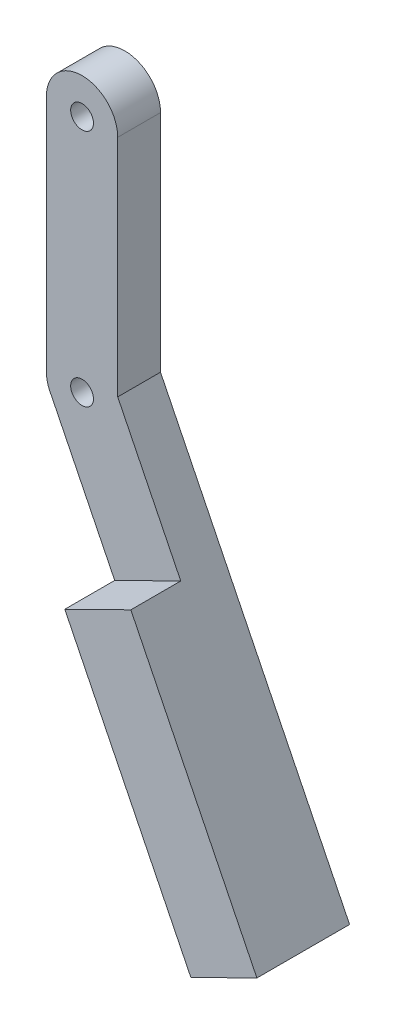
from build123d import *

# Parameters (mm, degrees)
SALIENTE_EXTRUIR1_DEPTH = 6
CROQUIS2_R              = 1.6
CORTAR_EXTRUIR1_DEPTH   = 65.918146911
SALIENTE_EXTRUIR2_DEPTH = 7


with BuildPart() as part:
    # Croquis1 → Saliente-Extruir1 (new body)
    with BuildSketch(Plane.XY):
        with BuildLine():
            Line((-5, 33.48), (-5, 0))
            ThreePointArc((-5, 0), (0, -5), (5, 0))
            Line((5, 0), (5, 33.48))
            ThreePointArc((5, 33.48), (0, 38.48), (-5, 33.48))
        make_face()
        with BuildLine():
            ThreePointArc((5, 0), (1.357892891, -4.812081348), (-4.262450759, -2.613716421))
            Line((-4.262450759, -2.613716421), (22.256084979, -56.435340907))
            Line((22.256084979, -56.435340907), (31.518535738, -51.871624486))
            Line((31.518535738, -51.871624486), (5, 1.95))
            Line((5, 1.95), (5, 0))
        make_face()
    extrude(amount=SALIENTE_EXTRUIR1_DEPTH)

    # Croquis2 → Cortar-Extruir1 (cut, through all)
    with BuildSketch(Plane.XY.offset(6)):
        with Locations((0, 33.48)):
            Circle(CROQUIS2_R)
        Circle(CROQUIS2_R)
    extrude(amount=-CORTAR_EXTRUIR1_DEPTH, mode=Mode.SUBTRACT)

    # Croquis3 → Saliente-Extruir2 (add)
    with BuildSketch(Plane(origin=(0, 0, 6), x_dir=(-1, 0, 0), z_dir=(0, 0, -1))):
        Polygon((-31.518535738, -51.871624486), (-22.256084979, -56.435340907), (-4.577061154, -20.554257916), (-13.839511913, -15.990541495), align=None)
    extrude(amount=-SALIENTE_EXTRUIR2_DEPTH)


solid = part.part
